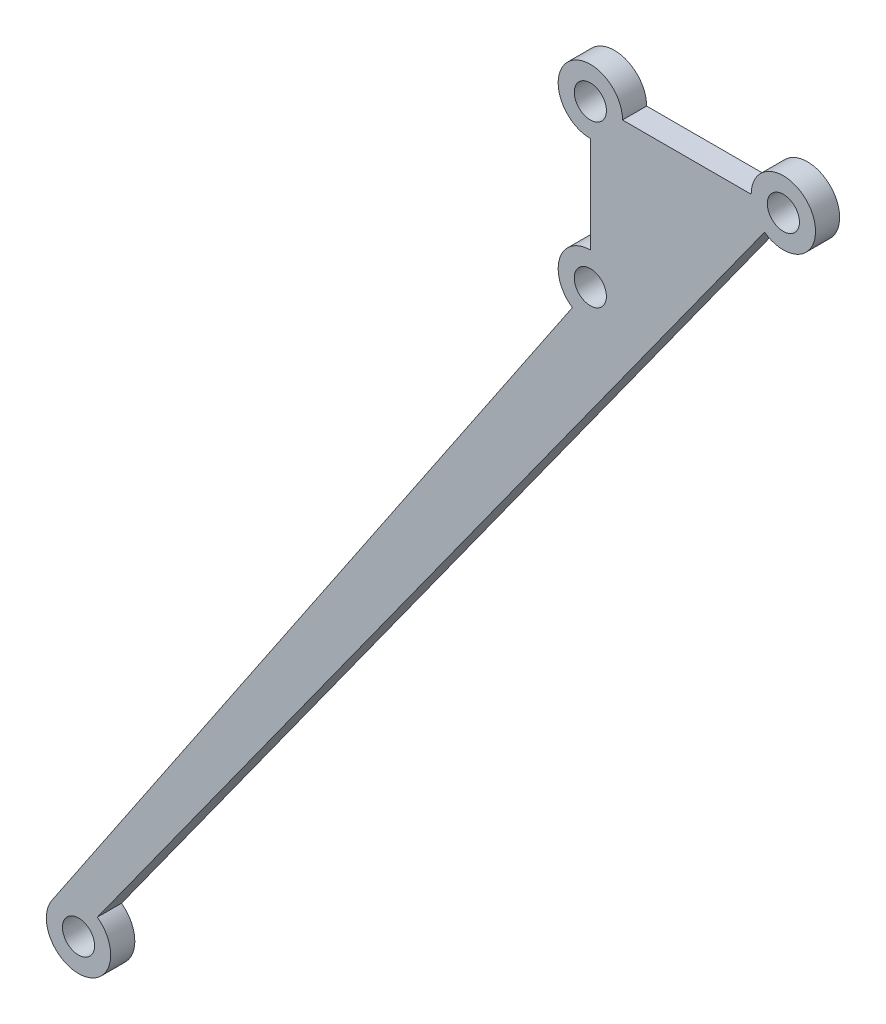
from build123d import *

# Parameters (mm, degrees)
SKETCH_1_R      = 1
EXTRUDE_1_DEPTH = 1.5


with BuildPart() as part:
    # 草图1 → 凸台-拉伸1 (new body)
    with BuildSketch(Plane.XY):
        with BuildLine():
            Line((10.83152947, -1.623168698), (-30.649174333, -59.245657467))
            ThreePointArc((-30.649174333, -59.245657467), (-31.464927374, -62.837478083), (-33.476977186, -59.752306464))
            Line((-33.476977186, -59.752306464), (-1.116519701, -11.659332323))
            ThreePointArc((-1.116519701, -11.659332323), (-1.912938139, -9.416332563), (0, -8))
            Line((0, -8), (0, -2))
            ThreePointArc((0, -2), (-1.414213562, 1.414213562), (2, 0))
            Line((2, 0), (10, 0))
            ThreePointArc((10, 0), (13.780019812, 0.911882377), (10.83152947, -1.623168698))
        make_face()
        with Locations((-31.817644863, -60.868826165)):
            Circle(SKETCH_1_R, mode=Mode.SUBTRACT)
        Circle(SKETCH_1_R, mode=Mode.SUBTRACT)
        with Locations((12, 0)):
            Circle(SKETCH_1_R, mode=Mode.SUBTRACT)
        with Locations((0, -10)):
            Circle(SKETCH_1_R, mode=Mode.SUBTRACT)
    extrude(amount=EXTRUDE_1_DEPTH)


solid = part.part
